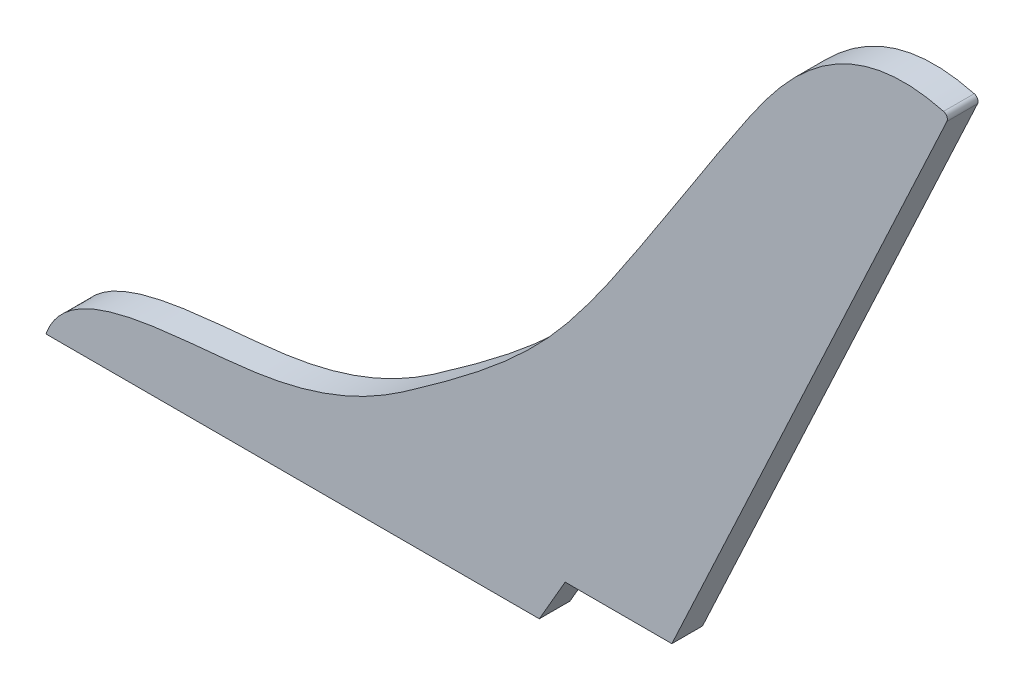
from build123d import *

# Parameters (mm, degrees)
BOSS_EXTRUDE1_DEPTH = 152.4
FILLET1_R           = 25.4


with BuildPart() as part:
    # Sketch1 → Boss-Extrude1 (new body)
    with BuildSketch(Plane.XY):
        with BuildLine():
            Line((0, 0), (2453.64, 0))
            Line((2453.64, 0), (2582.102744296, 222.504))
            Line((2582.102744296, 222.504), (3112.917808657, 222.504))
            Line((3112.917808657, 222.504), (4493.361010629, 3182.874))
            add(Edge.make_bspline(
                [(0, 0), (116.998830003, 333.573371339), (1063.479959181, 273.483968866), (1615.605801809, 525.977034044), (2074.666267804, 847.032915734), (2399.476424156, 1097.38893033), (2745.924318913, 1535.792394611), (2889.333282638, 1753.369272984), (3207.904477215, 2236.567384367), (3278.555026222, 2366.317843455), (3948.747804981, 3347.088718294), (4493.361010629, 3182.874)],
                knots=[0, 0, 0, 0, 0.1321567, 0.223213503, 0.257951388, 0.454915081, 0.494597021, 0.61508885, 0.653759963, 0.84263704, 1, 1, 1, 1], degree=3))
        make_face()
    extrude(amount=BOSS_EXTRUDE1_DEPTH)

    # Fillet1
    fillet1_edges = [part.edges().sort_by_distance(p)[0] for p in [
        (4493.361010629, 3182.874, 76.2),
    ]]
    fillet(fillet1_edges, radius=FILLET1_R)


solid = part.part
